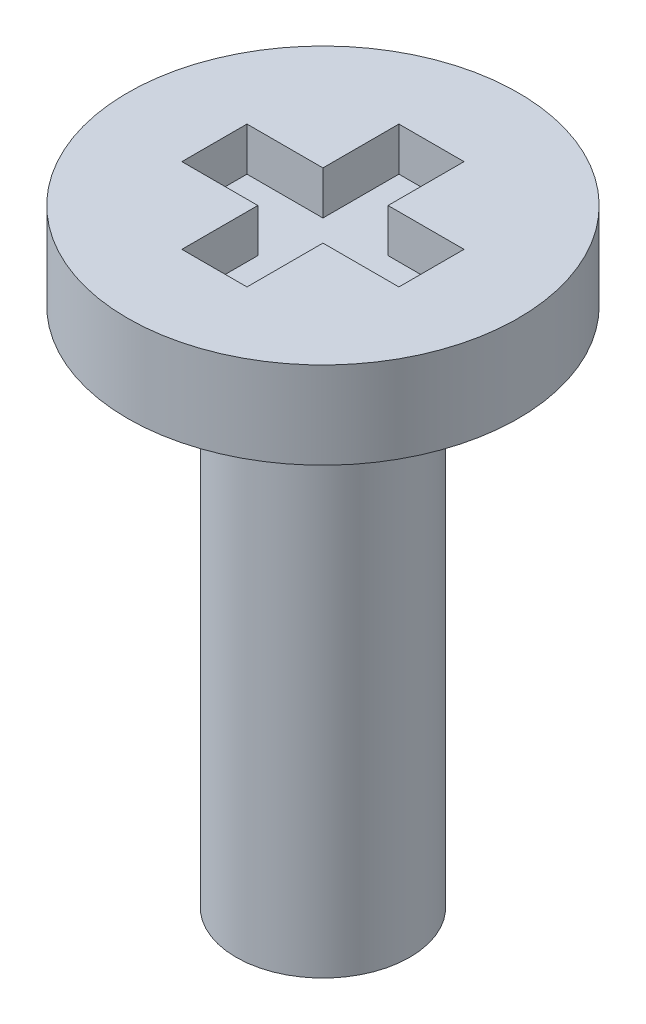
from build123d import *

# Parameters (mm, degrees)
SKETCH_1_R          = 1
EXTRUDE_1_DEPTH     = 6
SKETCH_2_R          = 2.25
EXTRUDE_2_DEPTH     = 1
SKETCH_3_W          = 2.5
SKETCH_3_H          = 0.75
CUT_EXTRUDE_1_DEPTH = 0.5
SKETCH_4_W          = 0.75
SKETCH_4_H          = 2.5
CUT_EXTRUDE_2_DEPTH = 0.5


with BuildPart() as part:
    # 草图1 → 拉伸1 (new body)
    with BuildSketch(Plane(origin=(0, 0, 0), x_dir=(1, 0, 0), z_dir=(0, 1, 0))):
        with Locations(Location((0, 0, 0), (0, 0, 270))):
            Circle(SKETCH_1_R)
    extrude(amount=EXTRUDE_1_DEPTH)

    # 草图2 → 拉伸2 (add)
    with BuildSketch(Plane(origin=(0, 6, 0), x_dir=(-1, 0, 0), z_dir=(0, 1, 0))):
        with Locations(Location((0, 0, 0), (0, 0, 90))):
            Circle(SKETCH_2_R)
    extrude(amount=EXTRUDE_2_DEPTH)

    # 草图3 → 切除-拉伸1 (cut)
    with BuildSketch(Plane(origin=(0, 7, 0), x_dir=(-1, 0, 0), z_dir=(0, 1, 0))):
        Rectangle(SKETCH_3_W, SKETCH_3_H)
    extrude(amount=-CUT_EXTRUDE_1_DEPTH, mode=Mode.SUBTRACT)

    # 草图4 → 切除-拉伸2 (cut)
    with BuildSketch(Plane(origin=(0, 7, 0), x_dir=(-1, 0, 0), z_dir=(0, 1, 0))):
        Rectangle(SKETCH_4_W, SKETCH_4_H)
    extrude(amount=-CUT_EXTRUDE_2_DEPTH, mode=Mode.SUBTRACT)


solid = part.part
